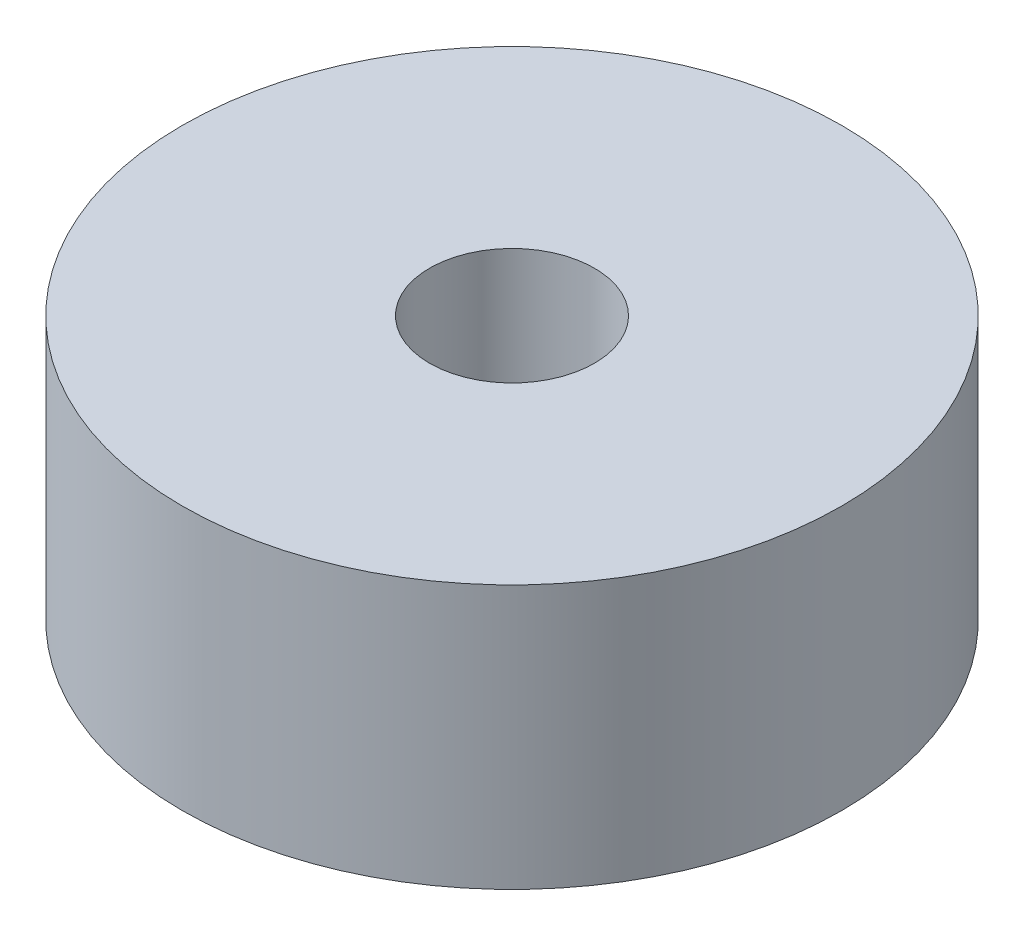
from build123d import *

# Parameters (mm, degrees)
SKETCH1_R           = 100
SKETCH1_R_2         = 25
BOSS_EXTRUDE1_DEPTH = 80


with BuildPart() as part:
    # Sketch1 → Boss-Extrude1 (new body)
    with BuildSketch(Plane(origin=(0, 0, 0), x_dir=(1, 0, 0), z_dir=(0, 1, 0))):
        with Locations(Location((0, 0, 0), (0, 0, 270))):
            Circle(SKETCH1_R)
        with Locations(Location((0, 0, 0), (0, 0, 270))):
            Circle(SKETCH1_R_2, mode=Mode.SUBTRACT)
    extrude(amount=BOSS_EXTRUDE1_DEPTH)


solid = part.part
